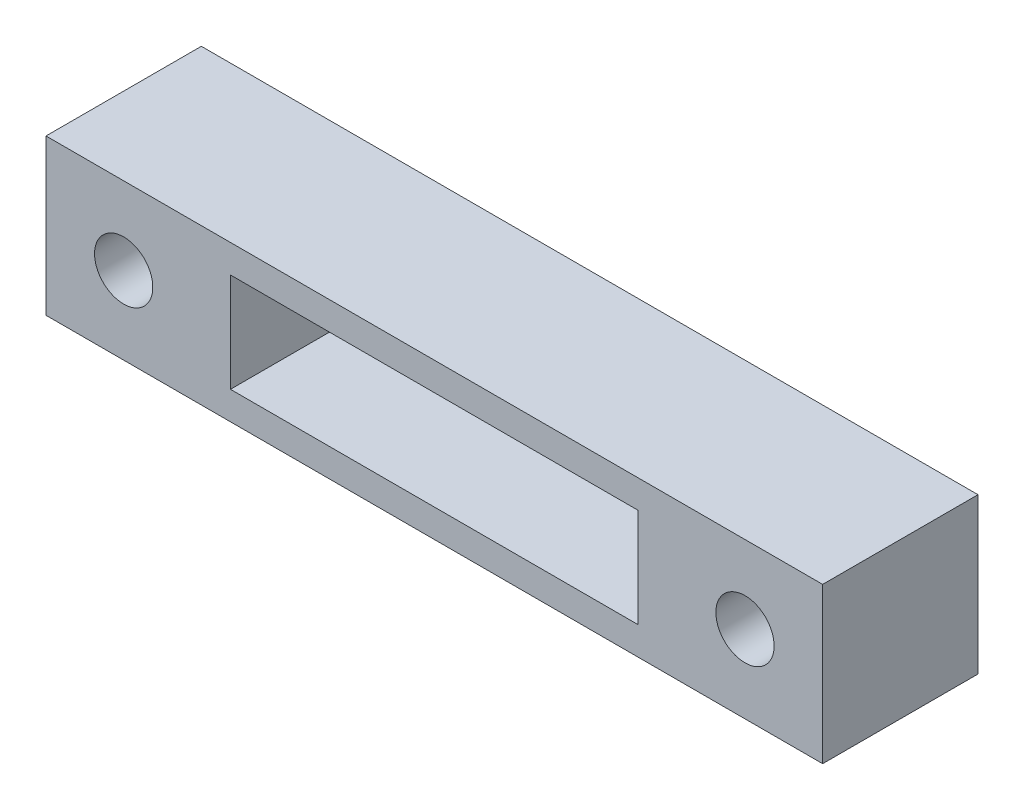
from build123d import *

# Parameters (mm, degrees)
SKETCH1_W           = 21
SKETCH1_H           = 5.5
BOSS_EXTRUDE1_DEPTH = 8
SKETCH2_W           = 21
SKETCH2_H           = 5.1
CUT_EXTRUDE1_DEPTH  = 5.5
SKETCH4_W           = 18
SKETCH4_H           = 3
CUT_EXTRUDE2_DEPTH  = 5.5
SKETCH5_R           = 1.5
CUT_EXTRUDE3_DEPTH  = 10.5


with BuildPart() as part:
    # Sketch1 → Boss-Extrude1 (new body)
    with BuildSketch(Plane(origin=(0, 0, 0), x_dir=(1, 0, 0), z_dir=(0, 1, 0))):
        Polygon((-20, 20), (-20, 12), (-10.5, 12), (-10.5, 17.5), (10.5, 17.5), (10.5, 12), (20, 12), (20, 20), align=None)
        with Locations((0, 14.75)):
            Rectangle(SKETCH1_W, SKETCH1_H)
    extrude(amount=BOSS_EXTRUDE1_DEPTH)

    # Sketch2 → Cut-Extrude1 (cut)
    with BuildSketch(Plane.XY.offset(-12)):
        with Locations((0, 4)):
            Rectangle(SKETCH2_W, SKETCH2_H)
    extrude(amount=-CUT_EXTRUDE1_DEPTH, mode=Mode.SUBTRACT)

    # Sketch4 → Cut-Extrude2 (cut)
    with BuildSketch(Plane.XY.offset(-17.5)):
        with Locations((0, 4)):
            Rectangle(SKETCH4_W, SKETCH4_H)
    extrude(amount=-CUT_EXTRUDE2_DEPTH, mode=Mode.SUBTRACT)

    # Sketch5 → Cut-Extrude3 (cut)
    with BuildSketch(Plane(origin=(0, 0, -20), x_dir=(-1, 0, 0), z_dir=(0, 0, -1))):
        with Locations((-16, 4)):
            Circle(SKETCH5_R)
        with Locations((16, 4)):
            Circle(SKETCH5_R)
    extrude(amount=-CUT_EXTRUDE3_DEPTH, mode=Mode.SUBTRACT)


solid = part.part
